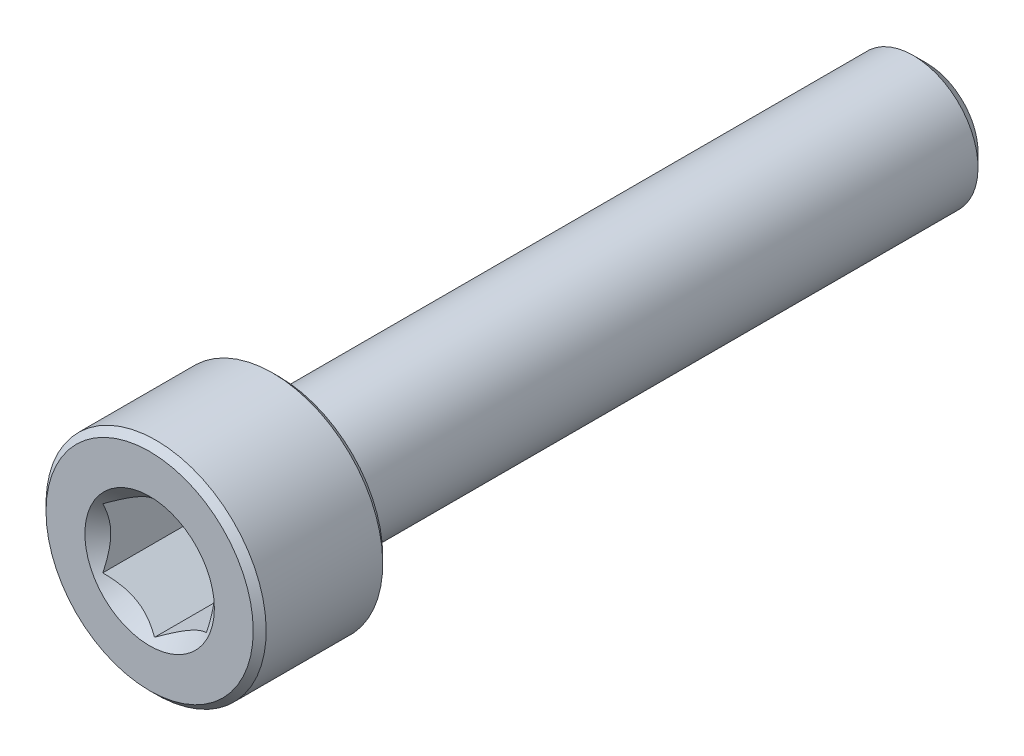
from build123d import *

# Parameters (mm, degrees)
CUT_EXTRUDE1_DEPTH = 4


with BuildPart() as part:
    # Sketch2 → Revolve1 (revolve)
    with BuildSketch(Plane(origin=(0, 0, 0), x_dir=(0, 0, -1), z_dir=(1, 0, 0))):
        with BuildLine():
            Line((-15, 0), (-15, 4))
            Line((-15, 4), (-14.75, 4.25))
            Line((-14.75, 4.25), (-10.25, 4.25))
            Line((-10.25, 4.25), (-10, 4))
            Line((-10, 4), (-10, 2.75))
            ThreePointArc((-10, 2.75), (-9.926776695, 2.573223305), (-9.75, 2.5))
            Line((-9.75, 2.5), (14.480384758, 2.5))
            Line((14.480384758, 2.5), (15, 1.980384758))
            Line((15, 1.980384758), (15, 0))
            Line((15, 0), (-15, 0))
        make_face()
    revolve(axis=Axis((0, 0, -15), (0, 0, 1)))

    # Sketch3 → Cut-Extrude1 (cut)
    with BuildSketch(Plane.XY.offset(15)):
        Polygon((2, -1.154700538), (2, 1.154700538), (0, 2.309401077), (-2, 1.154700538), (-2, -1.154700538), (0, -2.309401077), align=None)
    extrude(amount=-CUT_EXTRUDE1_DEPTH, mode=Mode.SUBTRACT)

    # Cut-Extrude2 cone 1 section (through the dimple's axis) → Cut-Extrude2 (revolve, cut)
    with BuildSketch(Plane(origin=(0, 0, 15), x_dir=(0, -1, 0), z_dir=(1, 0, 0))):
        Polygon((0, 0), (2.5, 0), (0, 2.5), align=None)
    revolve(axis=Axis((0, 0, 15), (0, 0, -1)), mode=Mode.SUBTRACT)


solid = part.part
